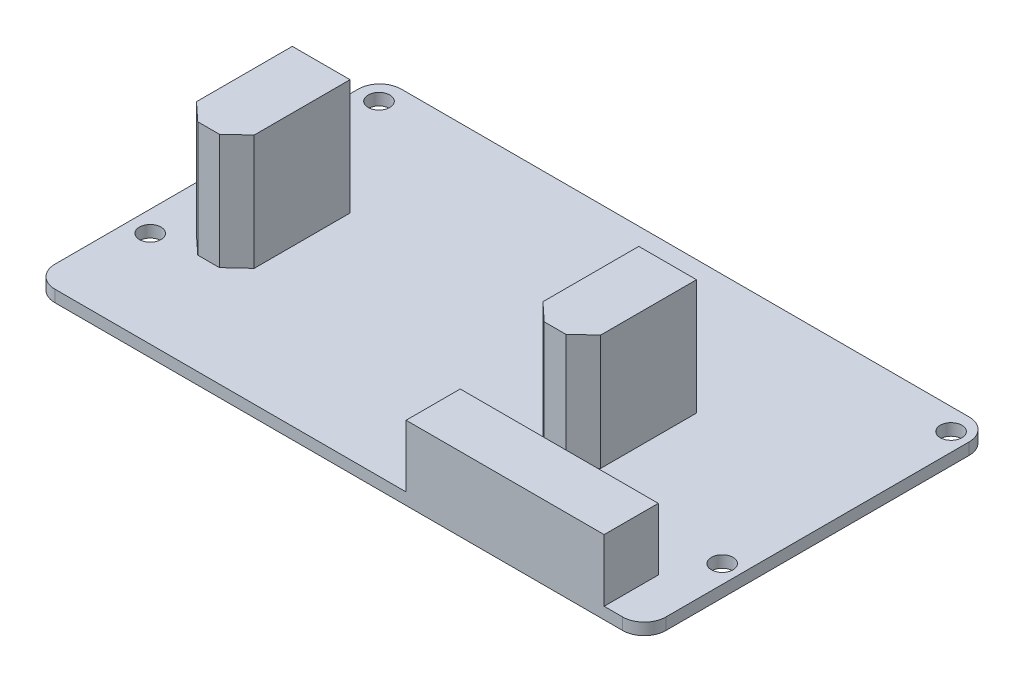
from build123d import *

# Parameters (mm, degrees)
SKETCH_1_W      = 84.65
SKETCH_1_H      = 48
SKETCH_1_R      = 1.5
EXTRUDE_1_DEPTH = 1.63
FILLET_1_R      = 3
SKETCH_4_W      = 7.5
SKETCH_4_H      = 8.6
EXTRUDE_2_DEPTH = 27.44
EXTRUDE_3_DEPTH = 16


with BuildPart() as part:
    # 草图1 → 凸台-拉伸1 (new body)
    with BuildSketch(Plane(origin=(0, 0, 0), x_dir=(1, 0, 0), z_dir=(0, 1, 0))):
        with Locations((42.325, 24)):
            Rectangle(SKETCH_1_W, SKETCH_1_H)
        with Locations(Location((2.9, 45, 0), (0, 0, 270))):
            Circle(SKETCH_1_R, mode=Mode.SUBTRACT)
        with Locations(Location((2.9, 13.3, 0), (0, 0, 270))):
            Circle(SKETCH_1_R, mode=Mode.SUBTRACT)
        with Locations(Location((82.15, 45, 0), (0, 0, 270))):
            Circle(SKETCH_1_R, mode=Mode.SUBTRACT)
        with Locations(Location((82.15, 13.3, 0), (0, 0, 270))):
            Circle(SKETCH_1_R, mode=Mode.SUBTRACT)
    extrude(amount=EXTRUDE_1_DEPTH)

    # 圆角1
    fillet_1_edges = [part.edges().sort_by_distance(p)[0] for p in [
        (0, 0.815, 0),
        (0, 0.815, -48),
        (84.65, 0.815, -48),
        (84.65, 0.815, 0),
    ]]
    fillet(fillet_1_edges, radius=FILLET_1_R)

    # 草图4 → 凸台-拉伸2 (add)
    with BuildSketch(Plane(origin=(51.65, 0, 0), x_dir=(0, 0, -1), z_dir=(1, 0, 0))):
        with Locations((3.75, 5.93)):
            Rectangle(SKETCH_4_W, SKETCH_4_H)
    extrude(amount=EXTRUDE_2_DEPTH)

    # 草图5 → 凸台-拉伸3 (add)
    with BuildSketch(Plane(origin=(0, 1.63, 0), x_dir=(1, 0, 0), z_dir=(0, 1, 0))):
        Polygon((62.31, 29.58), (62.31, 16.3), (59.81, 13.98), (58.31, 13.98), (56.81, 13.98), (54.31, 16.3), (54.31, 29.58), align=None)
        Polygon((10.31, 13.98), (8.81, 13.98), (6.31, 16.3), (6.31, 29.58), (14.31, 29.58), (14.31, 16.3), (11.81, 13.98), align=None)
    extrude(amount=EXTRUDE_3_DEPTH)


solid = part.part
